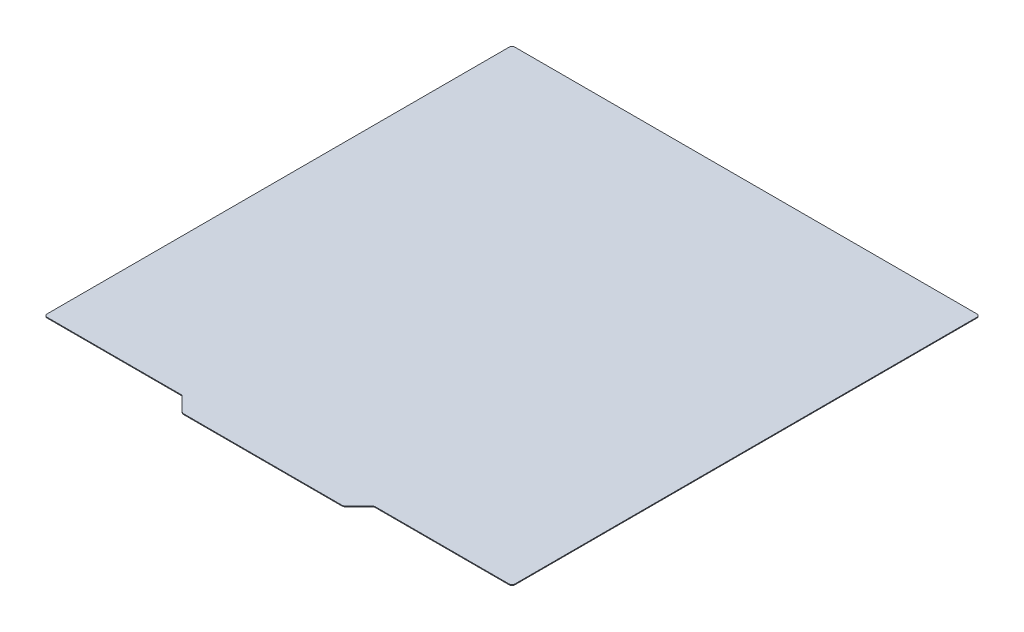
from build123d import *

# Parameters (mm, degrees)
BOSS_EXTRUDE1_DEPTH = 0.5
FILLET1_R           = 2


with BuildPart() as part:
    # Sketch1 → Boss-Extrude1 (new body)
    with BuildSketch(Plane(origin=(0, 0, 0), x_dir=(1, 0, 0), z_dir=(0, 1, 0))):
        Polygon((-52.5, -162.5), (52.5, -162.5), (62.5, -152.5), (152.5, -152.5), (152.5, 152.5), (-152.5, 152.5), (-152.5, -152.5), (-62.5, -152.5), align=None)
    extrude(amount=BOSS_EXTRUDE1_DEPTH)

    # Fillet1
    fillet1_edges = [part.edges().sort_by_distance(p)[0] for p in [
        (-152.5, 0.25, -152.5),
        (152.5, 0.25, -152.5),
        (152.5, 0.25, 152.5),
        (62.5, 0.25, 152.5),
        (52.5, 0.25, 162.5),
        (-52.5, 0.25, 162.5),
        (-62.5, 0.25, 152.5),
        (-152.5, 0.25, 152.5),
    ]]
    fillet(fillet1_edges, radius=FILLET1_R)


solid = part.part
